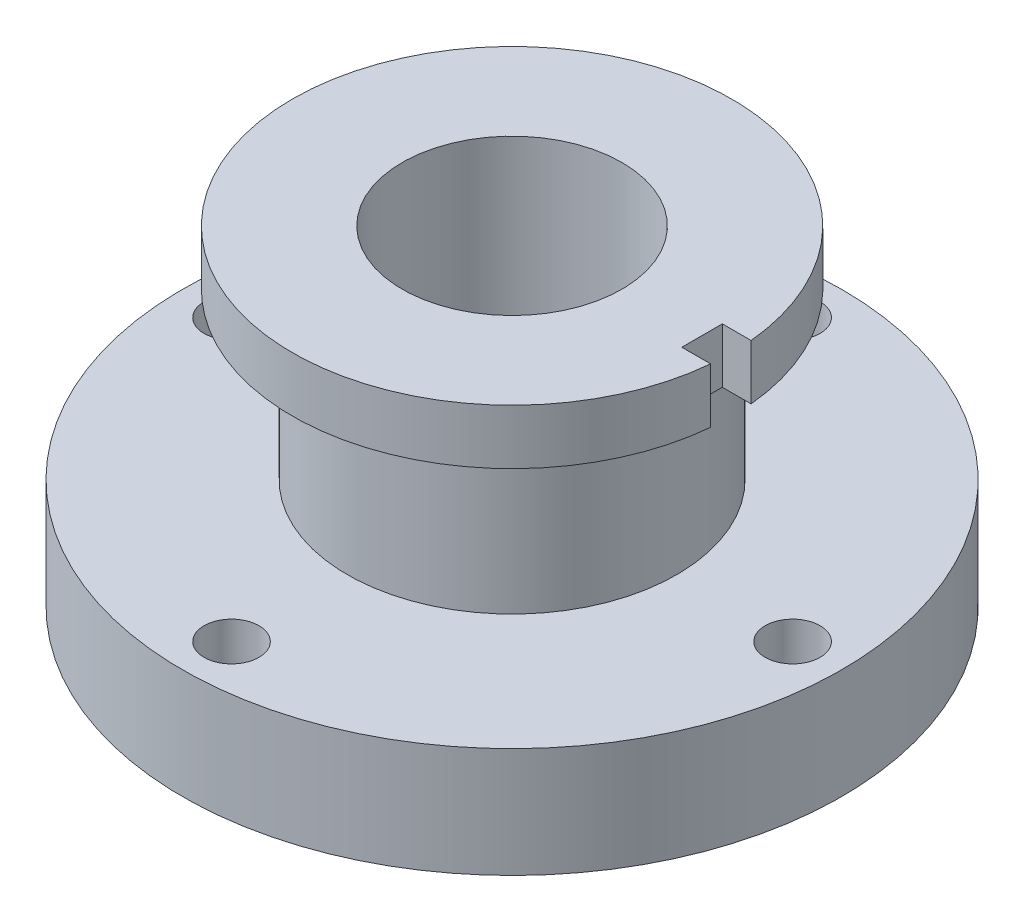
from build123d import *

# Parameters (mm, degrees)
SKETCH5_R          = 25
CUT_EXTRUDE2_DEPTH = 100
SKETCH6_W          = 54.11225924
SKETCH6_H          = 36.891131312
CUT_EXTRUDE3_DEPTH = 75


with BuildPart() as part:
    # Sketch4 → Revolve2 (revolve)
    with BuildSketch(Plane.XY):
        Polygon((0, -251.612903226), (0, -151.612903226), (100, -151.612903226), (100, 48.387096774), (152.822580645, 48.387096774), (200, 48.387096774), (200, -1.612903226), (150, -1.612903226), (150, -151.612903226), (300, -151.612903226), (300, -251.612903226), align=None)
    revolve(axis=Axis((0, -251.612903226, 0), (0, 1, 0)))

    # Sketch5 → Cut-Extrude2 (cut)
    with BuildSketch(Plane(origin=(0, -151.612903226, 0), x_dir=(1, 0, 0), z_dir=(0, 1, 0))):
        with Locations((0, 255.365455535)):
            Circle(SKETCH5_R)
        with Locations((255.365455535, 0)):
            Circle(SKETCH5_R)
        with Locations((0, -255.365455535)):
            Circle(SKETCH5_R)
        with Locations((-255.365455535, 0)):
            Circle(SKETCH5_R)
    extrude(amount=-CUT_EXTRUDE2_DEPTH, mode=Mode.SUBTRACT)

    # Sketch6 → Cut-Extrude3 (cut)
    with BuildSketch(Plane(origin=(0, 48.387096774, 0), x_dir=(1, 0, 0), z_dir=(0, 1, 0))):
        with Locations((200, 0)):
            Rectangle(SKETCH6_W, SKETCH6_H)
    extrude(amount=-CUT_EXTRUDE3_DEPTH, mode=Mode.SUBTRACT)


solid = part.part
